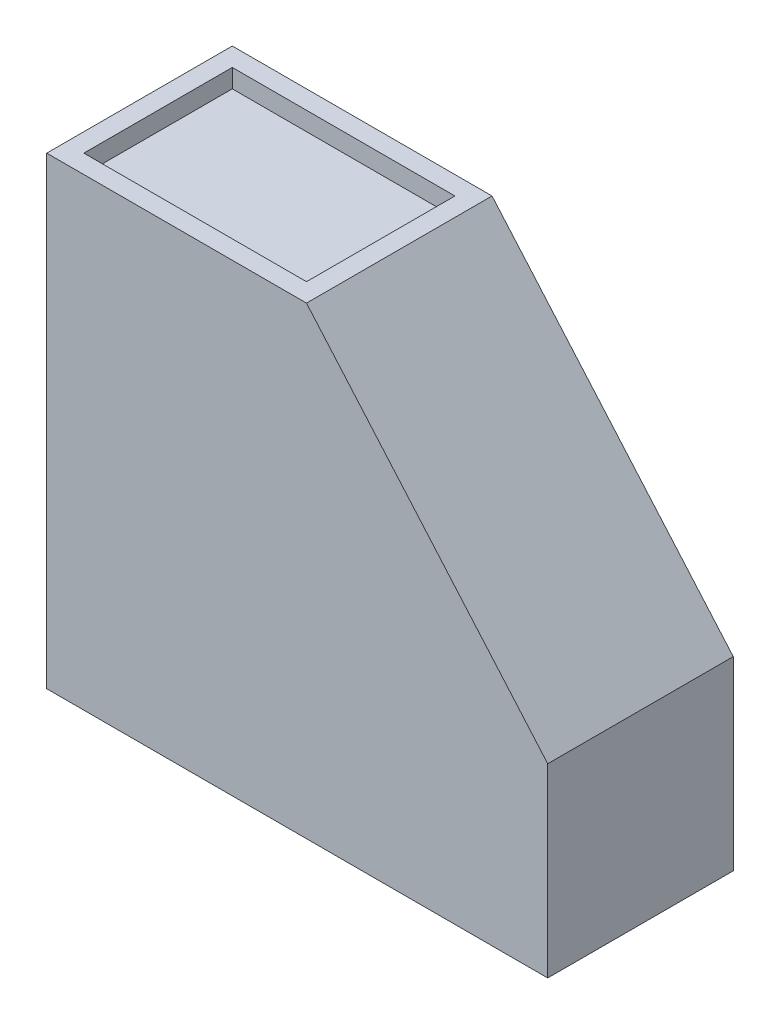
from build123d import *

# Parameters (mm, degrees)
BOSS_EXTRUDE1_DEPTH = 100
SKETCH2_W           = 120
SKETCH2_H           = 80
CUT_EXTRUDE1_DEPTH  = 10


with BuildPart() as part:
    # Sketch1 → Boss-Extrude1 (new body)
    with BuildSketch(Plane.XY):
        Polygon((135, -25), (5, 125), (-135, 125), (-135, -125), (135, -125), align=None)
    extrude(amount=BOSS_EXTRUDE1_DEPTH)

    # Sketch2 → Cut-Extrude1 (cut)
    with BuildSketch(Plane(origin=(0, 125, 0), x_dir=(1, 0, 0), z_dir=(0, 1, 0))):
        with Locations((-65, -50)):
            Rectangle(SKETCH2_W, SKETCH2_H)
    extrude(amount=-CUT_EXTRUDE1_DEPTH, mode=Mode.SUBTRACT)


solid = part.part
